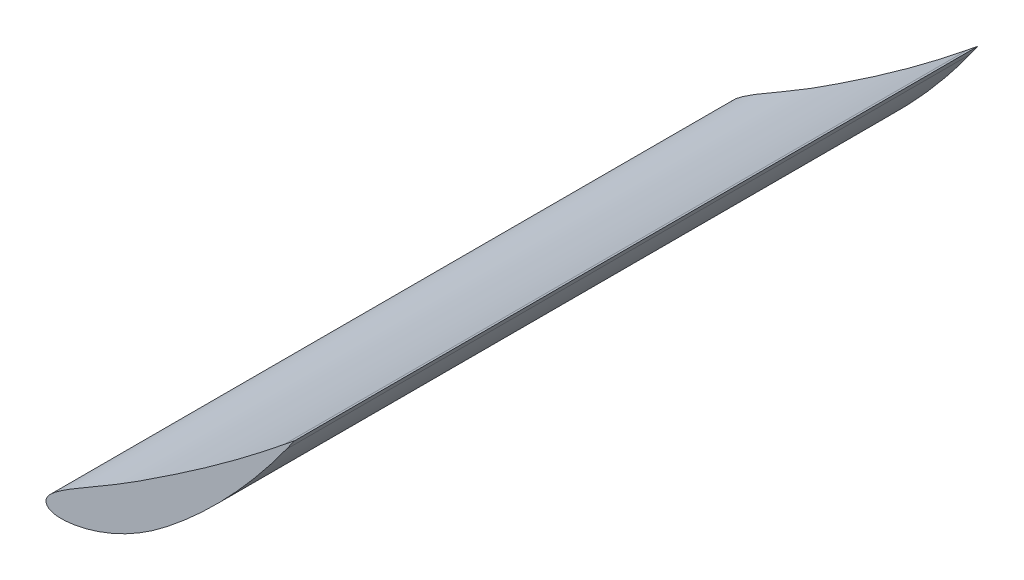
from build123d import *

# Parameters (mm, degrees)
BOSS_EXTRUDE3_DEPTH = 425.45


with BuildPart() as part:
    # Sketch3 → Boss-Extrude3 (new body)
    with BuildSketch(Plane.XY):
        with BuildLine():
            Line((147.626307276, 106.74449259), (154.117737428, 111.973090562))
            Line((154.117737428, 111.973090562), (148.978929373, 104.84319261))
            add(Edge.make_bspline(
                [(148.978929373, 104.84319261), (147.834744685, 103.255680492), (146.68530524, 101.672977453), (144.361898093, 98.530019287), (143.190158093, 96.967725398), (139.645008068, 92.308235263), (137.241896692, 89.23822127), (129.913950351, 80.136731496), (124.871724714, 74.212689984), (114.467092263, 62.657632207), (109.105193624, 57.026150866), (98.032608159, 46.082394159), (92.322489138, 40.769599146), (84.930116314, 34.361725194), (83.437812357, 33.090979267), (80.430756723, 30.579117663), (78.916861284, 29.339018727), (74.345235843, 25.664440425), (71.263883655, 23.266033292), (64.93797046, 18.718446877), (61.699777811, 16.5595428), (55.061658129, 12.488710961), (51.661584519, 10.57700703), (46.425995969, 7.916332873), (44.65817575, 7.063989495), (41.073696556, 5.43388191), (39.261461804, 4.658273041), (33.789423967, 2.469414603), (30.084329942, 1.186567713), (24.421201123, -0.411653922), (22.515782134, -0.889657121), (19.625134941, -1.506150914), (18.65454153, -1.694927345), (16.710482967, -2.031941293), (15.736882765, -2.180074611), (13.786002061, -2.428610494), (12.808748924, -2.529367981), (10.849538668, -2.669875822), (9.867664563, -2.710702798), (8.389932111, -2.708117782), (7.896535248, -2.696629367), (6.907719355, -2.647426564), (6.410896415, -2.609168002), (5.424405574, -2.497498089), (4.934142734, -2.424904156), (3.962048404, -2.23234095), (3.478532269, -2.111109568), (2.532033767, -1.802254977), (2.072867483, -1.616037219), (1.418543299, -1.25900009), (1.204872562, -1.126206477), (0.801080764, -0.83528577), (0.610413752, -0.676850934), (0.256756293, -0.328002207), (0.092496166, -0.135355615), (-0.190581619, 0.273645726), (-0.31102246, 0.490389135), (-0.507847811, 0.949440882), (-0.582772016, 1.190175678), (-0.677054608, 1.675896402), (-0.696583212, 1.925037481), (-0.683552407, 2.426459743), (-0.65185884, 2.672552614), (-0.548606513, 3.157426152), (-0.476469832, 3.397649841), (-0.211953468, 4.09834643), (0.025451512, 4.531910244), (0.567860041, 5.361876553), (0.872584973, 5.75839853), (1.513259414, 6.507863187), (1.850591902, 6.864699338), (2.895003445, 7.901075457), (3.635862392, 8.545044879), (5.161427794, 9.786811881), (5.948804456, 10.382977317), (8.337364615, 12.117157584), (9.971678635, 13.205324527), (13.275710825, 15.324295673), (14.946533013, 16.353311118), (18.305747248, 18.382874859), (19.994539263, 19.382775116), (25.072417098, 22.363840382), (28.472258263, 24.327579299), (35.256761648, 28.279650459), (38.641541722, 30.266667966), (45.370811289, 34.299725434), (48.715452266, 36.345558727), (53.690808322, 39.475288963), (55.342282038, 40.528760347), (58.629171024, 42.659239687), (60.265097943, 43.73549773), (65.170847586, 46.967248826), (68.440912269, 49.122387243), (78.223750648, 55.627897206), (84.715049934, 60.009743406), (97.596464756, 68.921738997), (103.986746325, 73.451645036), (116.650353009, 82.682878071), (122.924273702, 87.38333214), (132.24987643, 94.559004121), (135.344968314, 96.971512505), (139.965838234, 100.617026153), (141.502457946, 101.836819617), (144.569165149, 104.28463308), (146.098353984, 105.513784826), (147.626307276, 106.74449259)],
                knots=[0, 0, 0, 0, 0.015625, 0.015625, 0.03125, 0.03125, 0.0625, 0.0625, 0.125, 0.125, 0.1875, 0.1875, 0.25, 0.25, 0.265625, 0.265625, 0.28125, 0.28125, 0.3125, 0.3125, 0.34375, 0.34375, 0.375, 0.375, 0.390625, 0.390625, 0.40625, 0.40625, 0.4375, 0.4375, 0.453125, 0.453125, 0.4609375, 0.4609375, 0.46875, 0.46875, 0.4765625, 0.4765625, 0.484375, 0.484375, 0.48828125, 0.48828125, 0.4921875, 0.4921875, 0.49609375, 0.49609375, 0.5, 0.5, 0.50390625, 0.50390625, 0.505859375, 0.505859375, 0.5078125, 0.5078125, 0.509765625, 0.509765625, 0.51171875, 0.51171875, 0.513671875, 0.513671875, 0.515625, 0.515625, 0.517578125, 0.517578125, 0.51953125, 0.51953125, 0.5234375, 0.5234375, 0.52734375, 0.52734375, 0.53125, 0.53125, 0.5390625, 0.5390625, 0.546875, 0.546875, 0.5625, 0.5625, 0.578125, 0.578125, 0.59375, 0.59375, 0.625, 0.625, 0.65625, 0.65625, 0.6875, 0.6875, 0.703125, 0.703125, 0.71875, 0.71875, 0.75, 0.75, 0.8125, 0.8125, 0.875, 0.875, 0.9375, 0.9375, 0.96875, 0.96875, 0.984375, 0.984375, 1, 1, 1, 1], degree=3))
        make_face()
    extrude(amount=BOSS_EXTRUDE3_DEPTH)


solid = part.part
